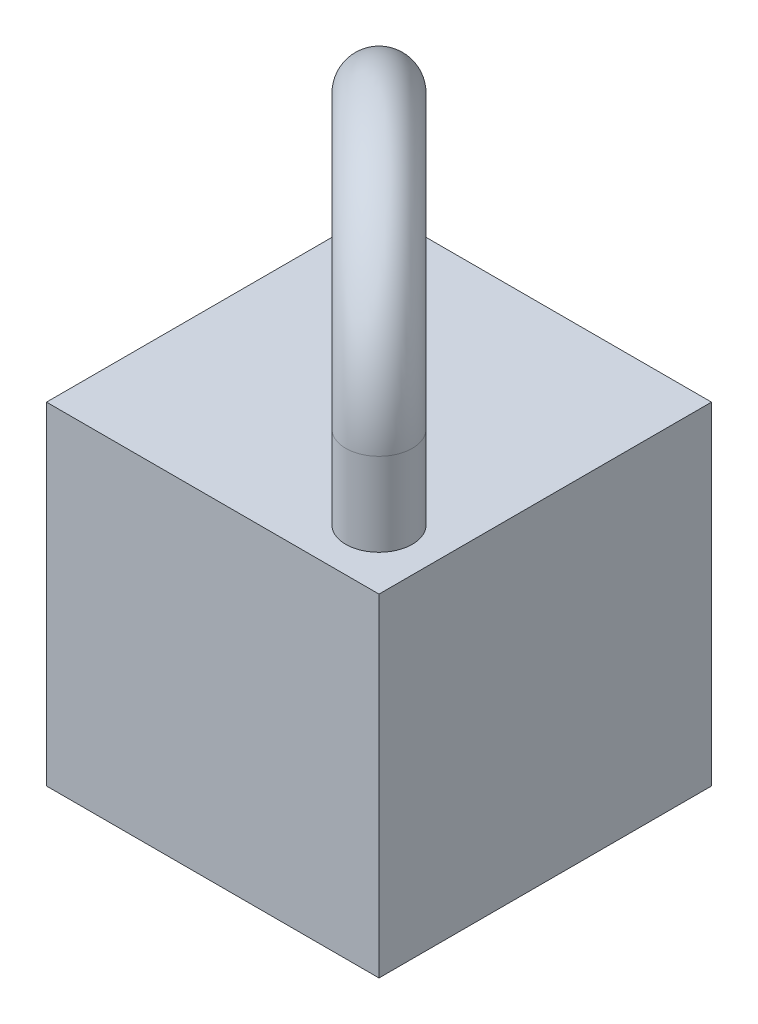
from build123d import *

# Parameters (mm, degrees)
SKETCH1_W           = 25.4
SKETCH1_H           = 25.4
BOSS_EXTRUDE1_DEPTH = 12.7
SKETCH2_R           = 2.54
REVOLVE1_ANGLE      = 180
BOSS_EXTRUDE2_REACH = 38.478
SKETCH2_3_R         = 2.54


with BuildPart() as part:
    # Sketch1 → Boss-Extrude1 (new, symmetric)
    with BuildSketch(Plane(origin=(0, 0, 0), x_dir=(1, 0, 0), z_dir=(0, 1, 0))):
        Rectangle(SKETCH1_W, SKETCH1_H)
    extrude(amount=BOSS_EXTRUDE1_DEPTH, both=True)

    # Sketch2<3> → Boss-Extrude2 (add, up to next)
    with BuildSketch(Plane(origin=(0, 19.05, 0), x_dir=(1, 0, 0), z_dir=(0, 1, 0)), mode=Mode.PRIVATE) as boss_extrude2_sk1:
        with Locations((8.141095825, -8.141095825)):
            Circle(SKETCH2_3_R)
    boss_extrude2_tool1 = extrude(boss_extrude2_sk1.sketch, amount=-BOSS_EXTRUDE2_REACH, mode=Mode.PRIVATE) - part.part
    # Sketch2<3> → Boss-Extrude2 (add, up to next)
    with BuildSketch(Plane(origin=(0, 19.05, 0), x_dir=(1, 0, 0), z_dir=(0, 1, 0)), mode=Mode.PRIVATE) as boss_extrude2_sk2:
        with Locations((-8.141095825, 8.141095825)):
            Circle(SKETCH2_3_R)
    boss_extrude2_tool2 = extrude(boss_extrude2_sk2.sketch, amount=-BOSS_EXTRUDE2_REACH, mode=Mode.PRIVATE) - part.part


with BuildPart() as body_2:
    # Sketch2 → Revolve1 (revolve)
    with BuildSketch(Plane(origin=(0, 19.05, 0), x_dir=(1, 0, 0), z_dir=(0, 1, 0))):
        with Locations((8.141095825, -8.141095825)):
            Circle(SKETCH2_R)
    revolve(axis=Axis((0, 19.05, 0), (-0.7071067811865464, 0, 0.7071067811865487)), revolution_arc=REVOLVE1_ANGLE)


with BuildPart() as part_1:
    add(part.part)

    add(body_2.part)  # Boss-Extrude2 merges body 2
    add(boss_extrude2_tool1.solids().sort_by_distance((8.141096, 19.05, 8.141096))[0])
    add(boss_extrude2_tool2.solids().sort_by_distance((-8.141096, 19.05, -8.141096))[0])


solid = part_1.part
